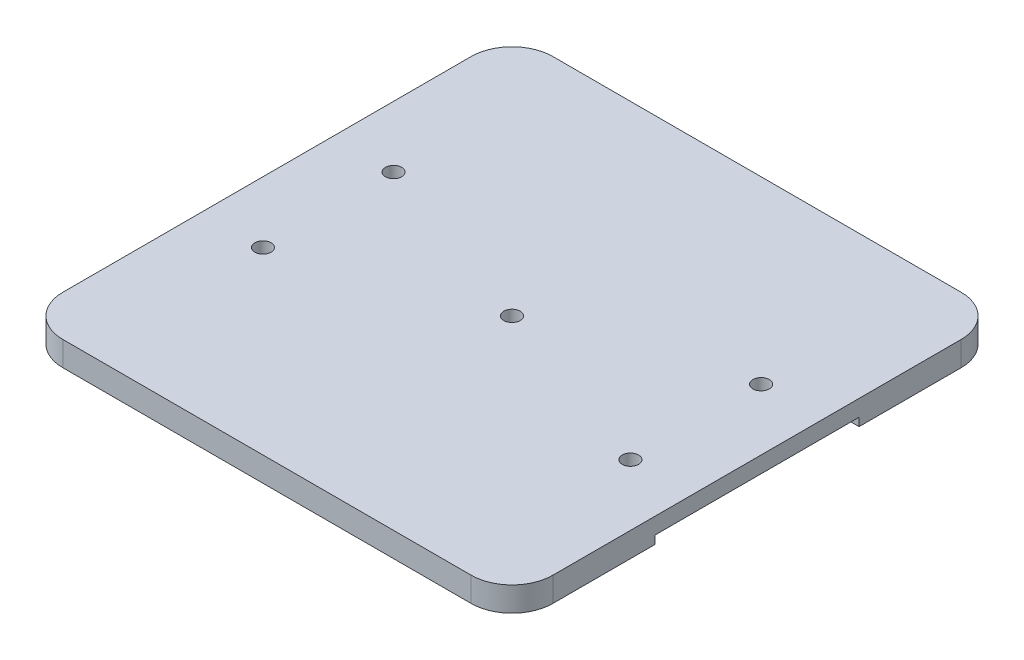
from build123d import *

# Parameters (mm, degrees)
BOSS_EXTRUDE1_DEPTH = 3
SKETCH2_W           = 15
SKETCH2_H           = 25
CUT_EXTRUDE1_DEPTH  = 1
SKETCH3_R           = 1
CUT_EXTRUDE2_DEPTH  = 2
SKETCH4_R           = 1
CUT_EXTRUDE4_DEPTH  = 3


with BuildPart() as part:
    # Sketch1 → Boss-Extrude1 (new body)
    with BuildSketch(Plane(origin=(0, 0, 0), x_dir=(1, 0, 0), z_dir=(0, 1, 0))):
        with BuildLine():
            Line((-32.058823529, 17.823529412), (17.941176471, 17.823529412))
            ThreePointArc((17.941176471, 17.823529412), (21.476710377, 16.359063318), (22.941176471, 12.823529412))
            Line((22.941176471, 12.823529412), (22.941176471, -37.176470588))
            ThreePointArc((22.941176471, -37.176470588), (21.476710377, -40.712004494), (17.941176471, -42.176470588))
            Line((17.941176471, -42.176470588), (-32.058823529, -42.176470588))
            ThreePointArc((-32.058823529, -42.176470588), (-35.594357435, -40.712004494), (-37.058823529, -37.176470588))
            Line((-37.058823529, -37.176470588), (-37.058823529, 12.823529412))
            ThreePointArc((-37.058823529, 12.823529412), (-35.594357435, 16.359063318), (-32.058823529, 17.823529412))
        make_face()
    extrude(amount=BOSS_EXTRUDE1_DEPTH)

    # Sketch2 → Cut-Extrude1 (cut)
    with BuildSketch(Plane(origin=(0, 0, 0), x_dir=(1, 0, 0), z_dir=(0, 1, 0))):
        with Locations((-29.558823529, -12.176470588)):
            Rectangle(SKETCH2_W, SKETCH2_H)
        with Locations((15.441176471, -12.176470588)):
            Rectangle(SKETCH2_W, SKETCH2_H)
    extrude(amount=CUT_EXTRUDE1_DEPTH, mode=Mode.SUBTRACT)

    # Sketch3 → Cut-Extrude2 (cut)
    with BuildSketch(Plane(origin=(0, 1, 0), x_dir=(-1, 0, 0), z_dir=(0, -1, 0))):
        with Locations(Location((29.558823529, -20.176470588, 0), (0, 0, 90))):
            Circle(SKETCH3_R)
        with Locations(Location((29.558823529, -4.176470588, 0), (0, 0, 90))):
            Circle(SKETCH3_R)
        with Locations(Location((-15.441176471, -20.176470588, 0), (0, 0, 90))):
            Circle(SKETCH3_R)
        with Locations(Location((-15.441176471, -4.176470588, 0), (0, 0, 90))):
            Circle(SKETCH3_R)
    extrude(amount=-CUT_EXTRUDE2_DEPTH, mode=Mode.SUBTRACT)

    # Sketch4 → Cut-Extrude4 (cut)
    with BuildSketch(Plane(origin=(0, 0, 0), x_dir=(-1, 0, 0), z_dir=(0, -1, 0))):
        with Locations(Location((7.058823529, -12.176470588, 0), (0, 0, 90))):
            Circle(SKETCH4_R)
    extrude(amount=-CUT_EXTRUDE4_DEPTH, mode=Mode.SUBTRACT)


solid = part.part
